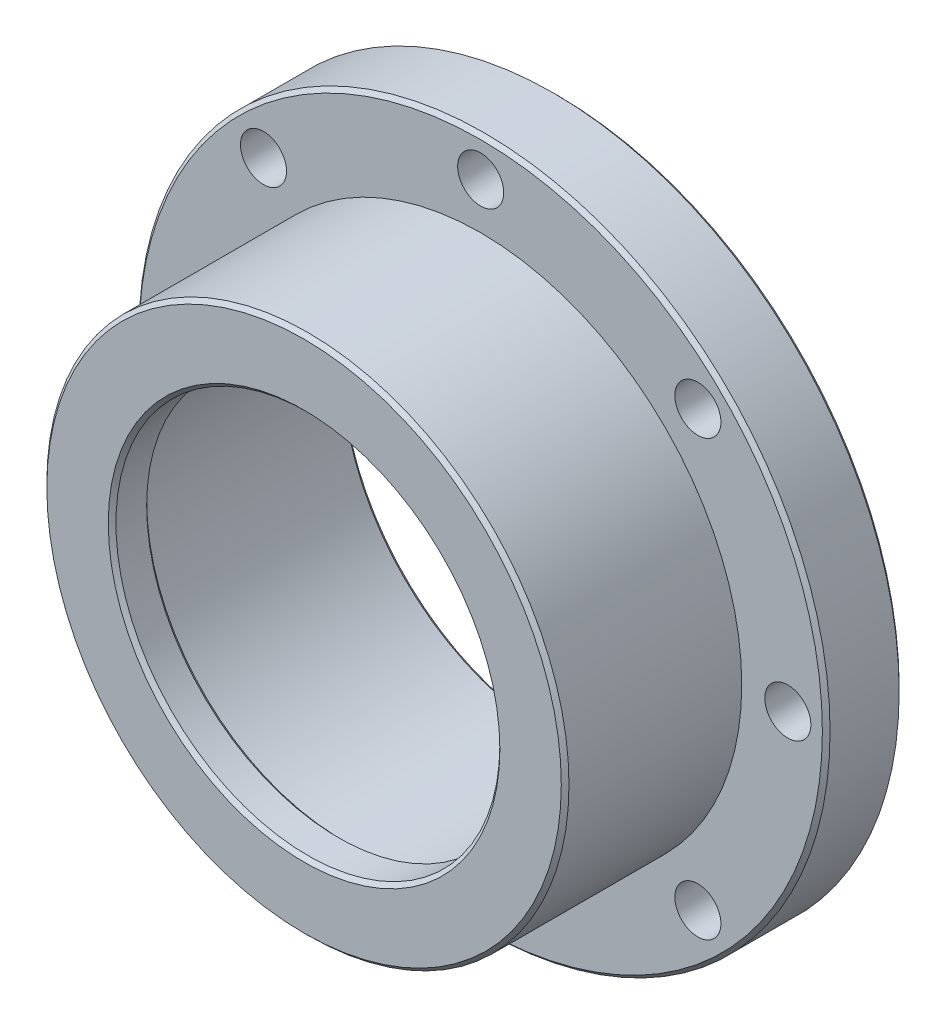
from build123d import *

# Parameters (mm, degrees)
SKETCH_1_R          = 45
EXTRUDE_1_DEPTH     = 10
SKETCH_2_R          = 34
EXTRUDE_2_DEPTH     = 23
SKETCH_4_R          = 25
CUT_EXTRUDE_1_DEPTH = 70
SKETCH_5_R          = 27.5
CUT_EXTRUDE_2_DEPTH = 28
SKETCH_6_R          = 3
CUT_EXTRUDE_3_DEPTH = 25
CHAMFER_1_SIZE      = 0.5


with BuildPart() as part:
    # 草图1 → 拉伸1 (new body)
    with BuildSketch(Plane.XY):
        Circle(SKETCH_1_R)
    extrude(amount=EXTRUDE_1_DEPTH)

    # 草图2 → 拉伸2 (add)
    with BuildSketch(Plane.XY.offset(10)):
        Circle(SKETCH_2_R)
    extrude(amount=EXTRUDE_2_DEPTH)

    # 草图4 → 切除-拉伸1 (cut)
    with BuildSketch(Plane.XY.offset(33)):
        Circle(SKETCH_4_R)
    extrude(amount=-CUT_EXTRUDE_1_DEPTH, mode=Mode.SUBTRACT)

    # 草图5 → 切除-拉伸2 (cut)
    with BuildSketch(Plane(origin=(0, 0, 0), x_dir=(-1, 0, 0), z_dir=(0, 0, -1))):
        Circle(SKETCH_5_R)
    extrude(amount=-CUT_EXTRUDE_2_DEPTH, mode=Mode.SUBTRACT)

    # 草图6 → 切除-拉伸3 (cut)
    with BuildSketch(Plane.XY.offset(10)):
        with Locations((28.284271247, 28.284271247)):
            Circle(SKETCH_6_R)
        with Locations((40, 0)):
            Circle(SKETCH_6_R)
        with Locations((28.284271247, -28.284271247)):
            Circle(SKETCH_6_R)
        with Locations((0, -40)):
            Circle(SKETCH_6_R)
        with Locations((-28.284271247, -28.284271247)):
            Circle(SKETCH_6_R)
        with Locations((0, 40)):
            Circle(SKETCH_6_R)
        with Locations((-40, 0)):
            Circle(SKETCH_6_R)
        with Locations((-28.284271247, 28.284271247)):
            Circle(SKETCH_6_R)
    extrude(amount=-CUT_EXTRUDE_3_DEPTH, mode=Mode.SUBTRACT)

    # 倒角1
    chamfer_1_edges = [part.edges().sort_by_distance(p)[0] for p in [
        (-25, 0, 33),
        (27.5, 0, 0),
        (-25, 0, 28),
        (-45, 0, 0),
        (-45, 0, 10),
        (-34, 0, 33),
    ]]
    chamfer(chamfer_1_edges, length=CHAMFER_1_SIZE)


solid = part.part
